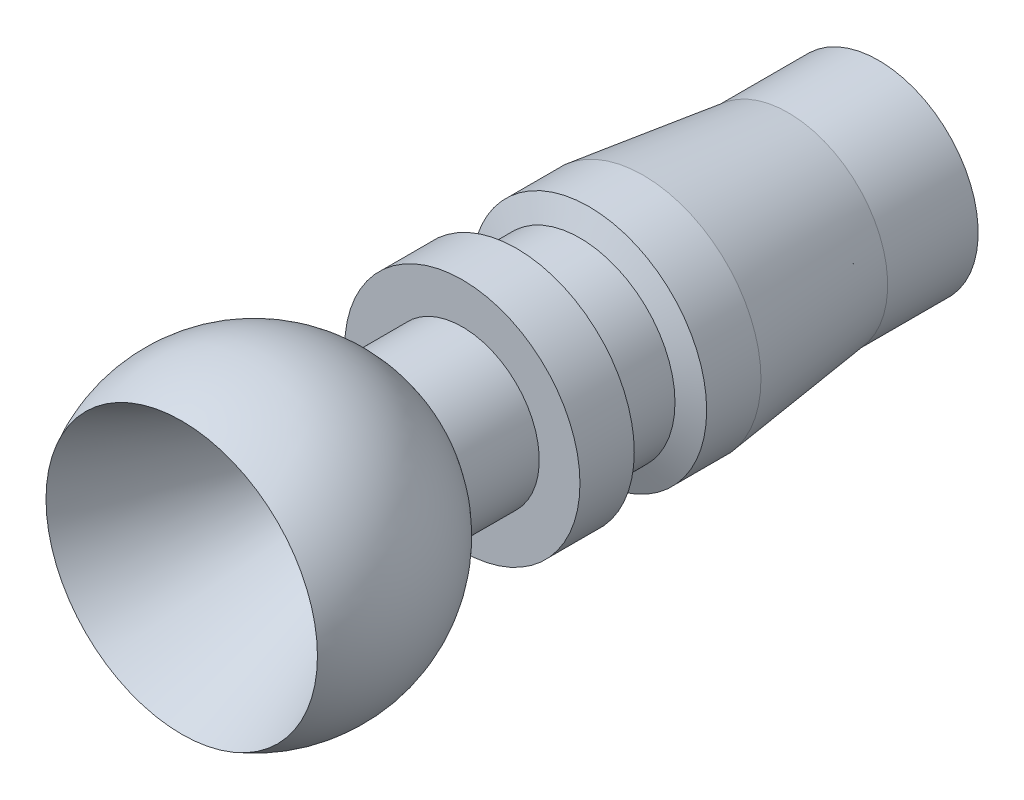
from build123d import *


with BuildPart() as part:
    # Sketch3 → Revolve1 (revolve)
    with BuildSketch(Plane(origin=(0, 0, 0), x_dir=(1, 0, 0), z_dir=(0, 1, 0)), mode=Mode.PRIVATE) as revolve1_sk:
        with BuildLine():
            Line((2.5, 0), (5.5, 0))
            Line((5.5, 0), (5.5, -5))
            Line((5.5, -5), (6.5, -13))
            Line((6.5, -13), (6.5, -16))
            Line((6.5, -16), (5.25, -16.5))
            Line((5.25, -16.5), (5.25, -20))
            Line((5.25, -20), (6.5, -20))
            Line((6.5, -20), (6.5, -23))
            Line((6.5, -23), (4.25, -23))
            Line((4.25, -23), (4.25, -26))
            Line((4.25, -26), (4.25, -27.138784068))
            ThreePointArc((4.25, -27.138784068), (8.172615224, -32.16368658), (7.498594715, -38.502633796))
            Line((7.498594715, -38.502633796), (2.5, -27.138784068))
            Line((2.5, -27.138784068), (2.5, 0))
        make_face()
    revolve(revolve1_sk.sketch.rotate(Axis((0, 0, -88.99), (0, 0, 1)), 180), axis=Axis((0, 0, -88.99), (0, 0, 1)))


solid = part.part
